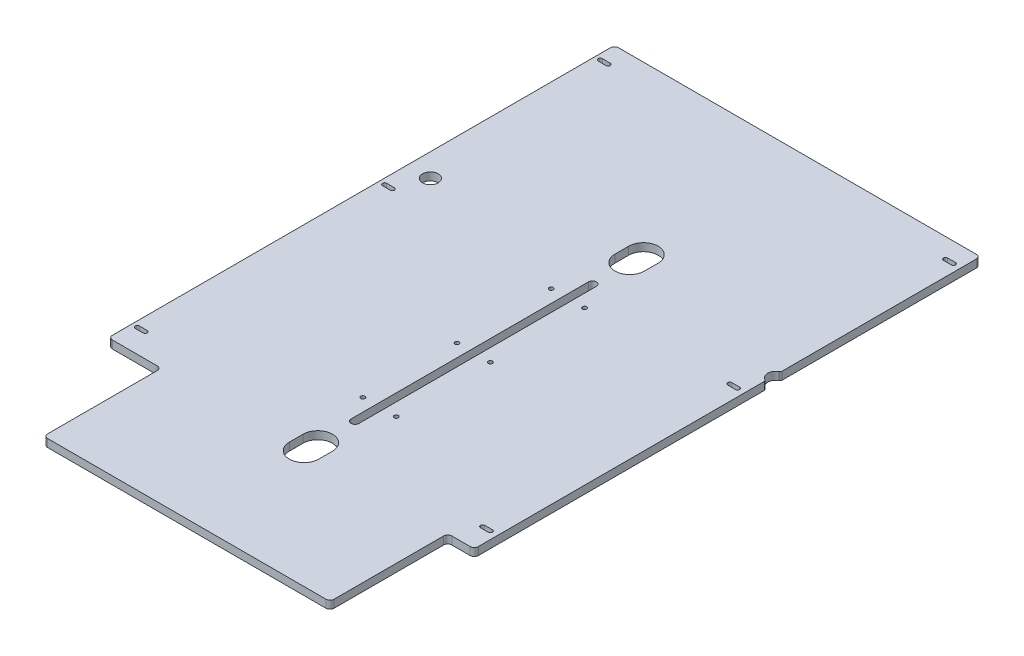
from build123d import *

# Parameters (mm, degrees)
BOSS_EXTRUDE1_DEPTH = 12.7
FILLET1_R           = 6.604
FILLET2_R           = 6.604
SKETCH2_R           = 12.7
CUT_EXTRUDE1_DEPTH  = 1020.273904858
CUT_EXTRUDE3_DEPTH  = 1020.273904858
CUT_EXTRUDE4_DEPTH  = 1020.273904858
SKETCH6_R           = 3.3782
CUT_EXTRUDE5_DEPTH  = 1020.273904858
CUT_EXTRUDE6_DEPTH  = 1020.273904858
CUT_EXTRUDE7_DEPTH  = 1019.820731075
FILLET3_R           = 3.175


with BuildPart() as part:
    # Sketch1 → Boss-Extrude1 (new body)
    with BuildSketch(Plane(origin=(0, 0, 0), x_dir=(1, 0, 0), z_dir=(0, 1, 0))):
        Polygon((0, 0), (96.04375, 0), (96.04375, -190.5), (559.59375, -190.5), (559.59375, 0), (606.425, 0), (606.425, 819.15), (0, 819.15), align=None)
        with BuildLine():
            Line((19.05, 41.4782), (31.75, 41.4782))
            ThreePointArc((31.75, 41.4782), (35.1282, 38.1), (31.75, 34.7218))
            Line((31.75, 34.7218), (19.05, 34.7218))
            ThreePointArc((19.05, 34.7218), (15.6718, 38.1), (19.05, 41.4782))
        make_face(mode=Mode.SUBTRACT)
        with BuildLine():
            Line((19.05, 441.5282), (31.75, 441.5282))
            ThreePointArc((31.75, 441.5282), (35.1282, 438.15), (31.75, 434.7718))
            Line((31.75, 434.7718), (19.05, 434.7718))
            ThreePointArc((19.05, 434.7718), (15.6718, 438.15), (19.05, 441.5282))
        make_face(mode=Mode.SUBTRACT)
        with BuildLine():
            Line((31.75, 784.0218), (19.05, 784.0218))
            ThreePointArc((19.05, 784.0218), (15.6718, 787.4), (19.05, 790.7782))
            Line((19.05, 790.7782), (31.75, 790.7782))
            ThreePointArc((31.75, 790.7782), (35.1282, 787.4), (31.75, 784.0218))
        make_face(mode=Mode.SUBTRACT)
        with BuildLine():
            Line((577.85, 784.0218), (590.55, 784.0218))
            ThreePointArc((590.55, 784.0218), (593.9282, 787.4), (590.55, 790.7782))
            Line((590.55, 790.7782), (577.85, 790.7782))
            ThreePointArc((577.85, 790.7782), (574.4718, 787.4), (577.85, 784.0218))
        make_face(mode=Mode.SUBTRACT)
        with BuildLine():
            Line((590.55, 441.5282), (577.85, 441.5282))
            ThreePointArc((577.85, 441.5282), (574.4718, 438.15), (577.85, 434.7718))
            Line((577.85, 434.7718), (590.55, 434.7718))
            ThreePointArc((590.55, 434.7718), (593.9282, 438.15), (590.55, 441.5282))
        make_face(mode=Mode.SUBTRACT)
        with BuildLine():
            Line((590.55, 41.4782), (577.85, 41.4782))
            ThreePointArc((577.85, 41.4782), (574.4718, 38.1), (577.85, 34.7218))
            Line((577.85, 34.7218), (590.55, 34.7218))
            ThreePointArc((590.55, 34.7218), (593.9282, 38.1), (590.55, 41.4782))
        make_face(mode=Mode.SUBTRACT)
    extrude(amount=BOSS_EXTRUDE1_DEPTH)

    # Fillet1
    fillet1_edges = [part.edges().sort_by_distance(p)[0] for p in [
        (559.59375, 6.35, 0),
        (96.04375, 6.35, 0),
    ]]
    fillet(fillet1_edges, radius=FILLET1_R)

    # Fillet2
    fillet2_edges = [part.edges().sort_by_distance(p)[0] for p in [
        (0, 6.35, -819.15),
        (606.425, 6.35, -819.15),
        (606.425, 6.35, 0),
        (559.59375, 6.35, 190.5),
        (96.04375, 6.35, 190.5),
        (0, 6.35, 0),
    ]]
    fillet(fillet2_edges, radius=FILLET2_R)

    # Sketch2 → Cut-Extrude1 (cut, through all)
    with BuildSketch(Plane(origin=(0, 12.7, 0), x_dir=(1, 0, 0), z_dir=(0, 1, 0))):
        with Locations(Location((47.625, 483.87, 0), (0, 0, 270))):
            Circle(SKETCH2_R)
        with BuildLine():
            Line((606.425, 505.867045256), (606.425, 461.872954744))
            ThreePointArc((606.425, 461.872954744), (604.723522628, 468.222954744), (600.075, 472.871477372))
            ThreePointArc((600.075, 472.871477372), (593.725, 483.87), (600.075, 494.868522628))
            ThreePointArc((600.075, 494.868522628), (604.723522628, 499.517045256), (606.425, 505.867045256))
        make_face()
    extrude(amount=-CUT_EXTRUDE1_DEPTH, mode=Mode.SUBTRACT)

    # Sketch4 → Cut-Extrude3 (cut, through all)
    with BuildSketch(Plane.XZ):
        with BuildLine():
            Line((350.8375, -527.05), (350.8375, -549.275))
            ThreePointArc((350.8375, -549.275), (327.025, -573.0875), (303.2125, -549.275))
            Line((303.2125, -549.275), (303.2125, -527.05))
            ThreePointArc((303.2125, -527.05), (327.025, -503.2375), (350.8375, -527.05))
        make_face()
        with BuildLine():
            Line((350.8375, 0), (350.8375, -22.225))
            ThreePointArc((350.8375, -22.225), (327.025, -46.0375), (303.2125, -22.225))
            Line((303.2125, -22.225), (303.2125, 0))
            ThreePointArc((303.2125, 0), (327.025, 23.8125), (350.8375, 0))
        make_face()
    extrude(amount=-CUT_EXTRUDE3_DEPTH, mode=Mode.SUBTRACT)

    # Sketch5 → Cut-Extrude4 (cut, through all)
    with BuildSketch(Plane.XZ):
        with BuildLine():
            Line((320.675, -466.725), (320.675, -82.55))
            ThreePointArc((320.675, -82.55), (327.025, -76.2), (333.375, -82.55))
            Line((333.375, -82.55), (333.375, -466.725))
            ThreePointArc((333.375, -466.725), (327.025, -473.075), (320.675, -466.725))
        make_face()
    extrude(amount=-CUT_EXTRUDE4_DEPTH, mode=Mode.SUBTRACT)

    # Sketch6 → Cut-Extrude5 (cut, through all)
    with BuildSketch(Plane.XZ):
        with Locations(Location((354.0125, -274.6375, 0), (0, 0, 270))):
            Circle(SKETCH6_R)
        with Locations(Location((354.0125, -427.0375, 0), (0, 0, 270))):
            Circle(SKETCH6_R)
        with Locations(Location((354.0125, -122.2375, 0), (0, 0, 90))):
            Circle(SKETCH6_R)
        with Locations(Location((300.0375, -427.0375, 0), (0, 0, 90))):
            Circle(SKETCH6_R)
        with Locations(Location((300.0375, -274.6375, 0), (0, 0, 90))):
            Circle(SKETCH6_R)
        with Locations(Location((300.0375, -122.2375, 0), (0, 0, 270))):
            Circle(SKETCH6_R)
    extrude(amount=-CUT_EXTRUDE5_DEPTH, mode=Mode.SUBTRACT)

    # Sketch7 → Cut-Extrude6 (cut, through all)
    with BuildSketch(Plane.XZ):
        with BuildLine():
            ThreePointArc((605.663, -812.546), (603.728733183, -817.215733183), (599.059, -819.15))
            Line((599.059, -819.15), (599.821, -819.15))
            ThreePointArc((599.821, -819.15), (604.490733183, -817.215733183), (606.425, -812.546))
            Line((606.425, -812.546), (606.425, -505.867045256))
            ThreePointArc((606.425, -505.867045256), (604.723522628, -499.517045256), (600.075, -494.868522628))
            ThreePointArc((600.075, -494.868522628), (604.165699913, -498.959222541), (605.663, -504.547222541))
            Line((605.663, -504.547222541), (605.663, -812.546))
        make_face()
        with BuildLine():
            ThreePointArc((0.762, -812.546), (2.696266817, -817.215733183), (7.366, -819.15))
            Line((7.366, -819.15), (6.604, -819.15))
            ThreePointArc((6.604, -819.15), (1.934266817, -817.215733183), (0, -812.546))
            Line((0, -812.546), (0, -6.604))
            ThreePointArc((0, -6.604), (1.934266817, -1.934266817), (6.604, 0))
            Line((6.604, 0), (7.366, 0))
            ThreePointArc((7.366, 0), (2.696266817, -1.934266817), (0.762, -6.604))
            Line((0.762, -6.604), (0.762, -812.546))
        make_face()
        with BuildLine():
            ThreePointArc((605.663, -462.330859906), (604.07096336, -468.487413325), (599.694, -473.100429953))
            ThreePointArc((599.694, -473.100429953), (599.883498256, -472.98428666), (600.075, -472.871477372))
            ThreePointArc((600.075, -472.871477372), (604.723522628, -468.222954744), (606.425, -461.872954744))
            Line((606.425, -461.872954744), (606.425, -6.604))
            ThreePointArc((606.425, -6.604), (604.490733183, -1.934266817), (599.821, 0))
            Line((599.821, 0), (599.059, 0))
            ThreePointArc((599.059, 0), (603.728733183, -1.934266817), (605.663, -6.604))
            Line((605.663, -6.604), (605.663, -462.330859906))
        make_face()
    extrude(amount=-CUT_EXTRUDE6_DEPTH, mode=Mode.SUBTRACT)

    # Sketch8 → Cut-Extrude7 (cut, through all)
    with BuildSketch(Plane(origin=(0, 12.7, 0), x_dir=(1, 0, 0), z_dir=(0, 1, 0))):
        with BuildLine():
            ThreePointArc((16.891, 819.15), (12.221266817, 817.215733183), (10.287, 812.546))
            Line((10.287, 812.546), (10.287, 6.604))
            ThreePointArc((10.287, 6.604), (12.221266817, 1.934266817), (16.891, 0))
            Line((16.891, 0), (7.366, 0))
            ThreePointArc((7.366, 0), (2.696266817, 1.934266817), (0.762, 6.604))
            Line((0.762, 6.604), (0.762, 812.546))
            ThreePointArc((0.762, 812.546), (2.696266817, 817.215733183), (7.366, 819.15))
            Line((7.366, 819.15), (16.891, 819.15))
        make_face()
        with BuildLine():
            Line((599.059, 819.15), (595.884, 819.15))
            ThreePointArc((595.884, 819.15), (600.553733183, 817.215733183), (602.488, 812.546))
            Line((602.488, 812.546), (602.488, 6.604))
            ThreePointArc((602.488, 6.604), (600.553733183, 1.934266817), (595.884, 0))
            Line((595.884, 0), (599.059, 0))
            ThreePointArc((599.059, 0), (603.728733183, 1.934266817), (605.663, 6.604))
            Line((605.663, 6.604), (605.663, 812.546))
            ThreePointArc((605.663, 812.546), (603.728733183, 817.215733183), (599.059, 819.15))
        make_face()
    extrude(amount=-CUT_EXTRUDE7_DEPTH, mode=Mode.SUBTRACT)

    # Fillet3
    fillet3_edges = [part.edges().sort_by_distance(p)[0] for p in [
        (602.488, 6.35, -470.731120318),
        (602.488, 6.35, -496.744211904),
    ]]
    fillet(fillet3_edges, radius=FILLET3_R)


solid = part.part
